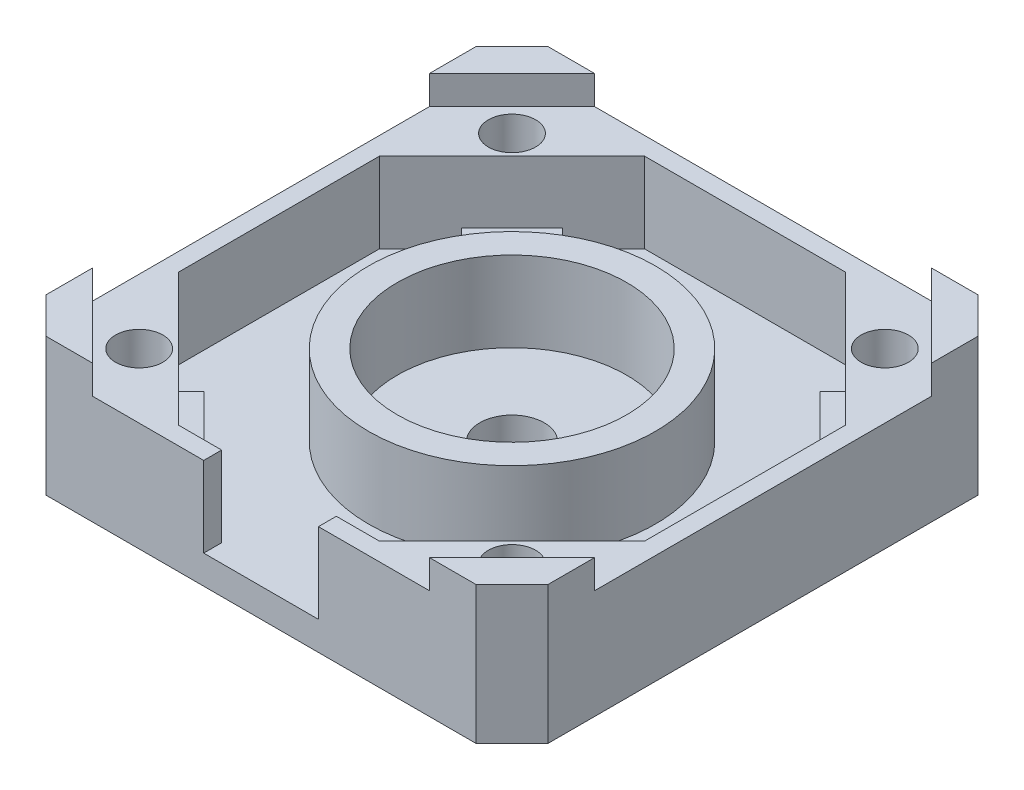
from build123d import *

# Parameters (mm, degrees)
SKETCH1_W           = 35
SKETCH1_H           = 35
BOSS_EXTRUDE1_DEPTH = 9.6
SKETCH2_R           = 10
SKETCH2_R_2         = 8
CUT_EXTRUDE1_DEPTH  = 7.6
CUT_EXTRUDE2_DEPTH  = 2
CHAMFER1_SIZE       = 2.5
SKETCH4_R           = 1.65
SKETCH4_R_2         = 2.25
CUT_EXTRUDE3_DEPTH  = 26.889380062
SKETCH5_R           = 3
CUT_EXTRUDE4_DEPTH  = 2.5
BOSS_EXTRUDE3_DEPTH = 1.25


with BuildPart() as part:
    # Sketch1 → Boss-Extrude1 (new body)
    with BuildSketch(Plane(origin=(0, 0, 0), x_dir=(1, 0, 0), z_dir=(0, 1, 0))):
        Rectangle(SKETCH1_W, SKETCH1_H)
    extrude(amount=BOSS_EXTRUDE1_DEPTH)

    # Sketch2 → Cut-Extrude1 (cut)
    # profile 1 of 2: a face of its own
    with BuildSketch(Plane(origin=(0, 9.6, 0), x_dir=(1, 0, 0), z_dir=(0, 1, 0))):
        Polygon((16.25, 7), (7, 16.25), (-7, 16.25), (-16.25, 7), (-16.25, -7), (-7, -16.25), (-4, -16.25), (-4, -17.5), (4, -17.5), (4, -16.25), (7, -16.25), (16.25, -7), align=None)
        with Locations(Location((0, 0, 0), (0, 0, 270))):
            Circle(SKETCH2_R, mode=Mode.SUBTRACT)
    # profile 2 of 2: a face of its own
    with BuildSketch(Plane(origin=(0, 9.6, 0), x_dir=(1, 0, 0), z_dir=(0, 1, 0))):
        with Locations(Location((0, 0, 0), (0, 0, 270))):
            Circle(SKETCH2_R_2)
    extrude(amount=-CUT_EXTRUDE1_DEPTH, mode=Mode.SUBTRACT)

    # Sketch3 → Cut-Extrude2 (cut)
    with BuildSketch(Plane(origin=(0, 9.6, 0), x_dir=(1, 0, 0), z_dir=(0, 1, 0))):
        Polygon((11.75, 17.5), (-11.75, 17.5), (-17.5, 11.75), (-17.5, -11.75), (-11.75, -17.5), (11.75, -17.5), (17.5, -11.75), (17.5, 11.75), align=None)
    extrude(amount=-CUT_EXTRUDE2_DEPTH, mode=Mode.SUBTRACT)

    # Chamfer1
    chamfer1_edges = [part.edges().sort_by_distance(p)[0] for p in [
        (17.5, 4.8, 17.5),
        (-17.5, 4.8, 17.5),
        (-17.5, 4.8, -17.5),
        (17.5, 4.8, -17.5),
    ]]
    chamfer(chamfer1_edges, length=CHAMFER1_SIZE)

    # Sketch4 → Cut-Extrude3 (cut, through all)
    with BuildSketch(Plane(origin=(0, 7.6, 0), x_dir=(1, 0, 0), z_dir=(0, 1, 0))):
        with Locations(Location((-13, 13, 0), (0, 0, 270))):
            Circle(SKETCH4_R)
        with Locations(Location((13, 13, 0), (0, 0, 90))):
            Circle(SKETCH4_R)
        with Locations(Location((13, -13, 0), (0, 0, 270))):
            Circle(SKETCH4_R)
        with Locations(Location((-13, -13, 0), (0, 0, 90))):
            Circle(SKETCH4_R)
        with Locations(Location((0, 0, 0), (0, 0, 270))):
            Circle(SKETCH4_R_2)
    extrude(amount=-CUT_EXTRUDE3_DEPTH, mode=Mode.SUBTRACT)

    # Sketch5 → Cut-Extrude4 (cut)
    with BuildSketch(Plane.XZ):
        with Locations(Location((13, 13, 0), (0, 0, 270))):
            Circle(SKETCH5_R)
        with Locations(Location((13, -13, 0), (0, 0, 184.59538669))):
            Circle(SKETCH5_R)
        with Locations(Location((-13, -13, 0), (0, 0, 270))):
            Circle(SKETCH5_R)
        with Locations(Location((-13, 13, 0), (0, 0, 265.40461331))):
            Circle(SKETCH5_R)
    extrude(amount=-CUT_EXTRUDE4_DEPTH, mode=Mode.SUBTRACT)

    # Sketch6 → Boss-Extrude3 (add)
    with BuildSketch(Plane(origin=(0, 2, 0), x_dir=(1, 0, 0), z_dir=(0, 1, 0))):
        Polygon((13.392766953, 9.857233047), (9.857233047, 13.392766953), (8.973349571, 12.508883476), (12.508883476, 8.973349571), align=None)
        Polygon((9.857233047, -13.392766953), (8.973349571, -12.508883476), (12.508883476, -8.973349571), (13.392766953, -9.857233047), align=None)
        Polygon((-13.392766953, -9.857233047), (-9.857233047, -13.392766953), (-8.973349571, -12.508883476), (-12.508883476, -8.973349571), align=None)
        Polygon((-9.857233047, 13.392766953), (-8.973349571, 12.508883476), (-12.508883476, 8.973349571), (-13.392766953, 9.857233047), align=None)
    extrude(amount=BOSS_EXTRUDE3_DEPTH)


solid = part.part
